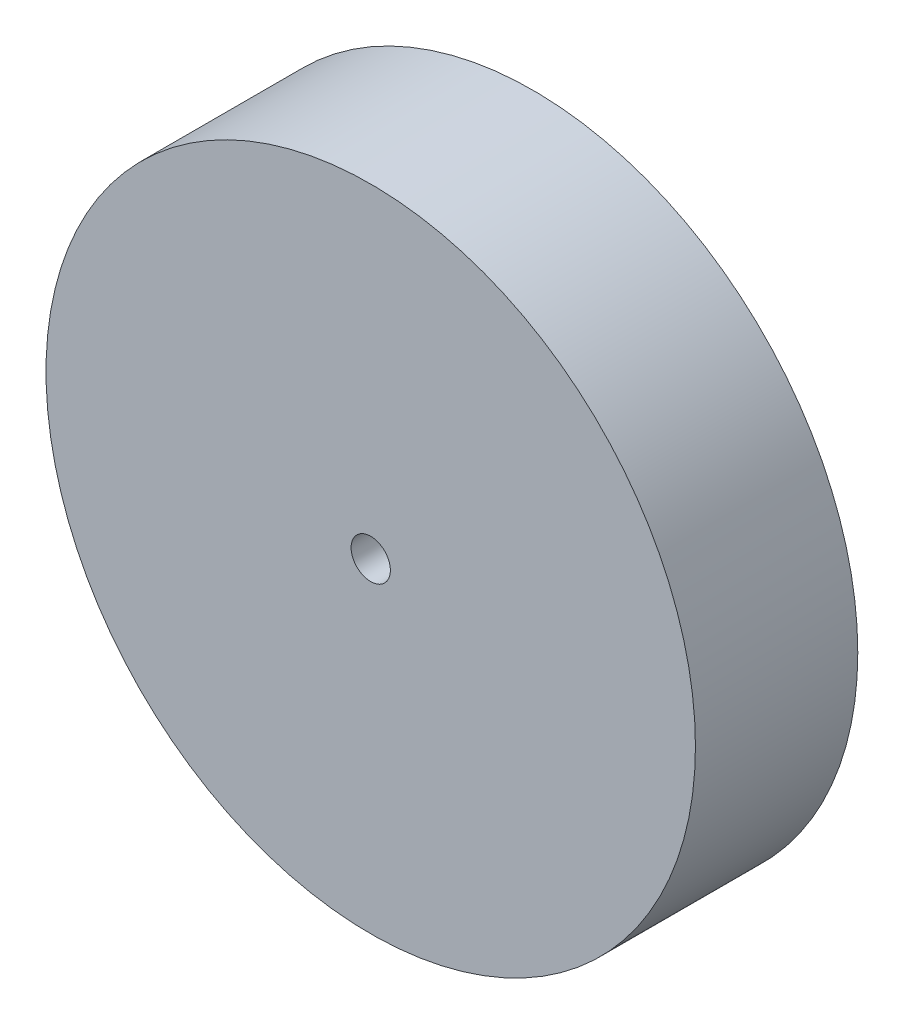
from build123d import *

# Parameters (mm, degrees)
SCHIZZO1_R                   = 100
SCHIZZO1_R_2                 = 6.05
ESTRUSIONE_ESTRUSIONE1_DEPTH = 25


with BuildPart() as part:
    # Schizzo1 → Estrusione-Estrusione1 (new, symmetric)
    with BuildSketch(Plane.XY):
        Circle(SCHIZZO1_R)
        Circle(SCHIZZO1_R_2, mode=Mode.SUBTRACT)
    extrude(amount=ESTRUSIONE_ESTRUSIONE1_DEPTH, both=True)


solid = part.part
